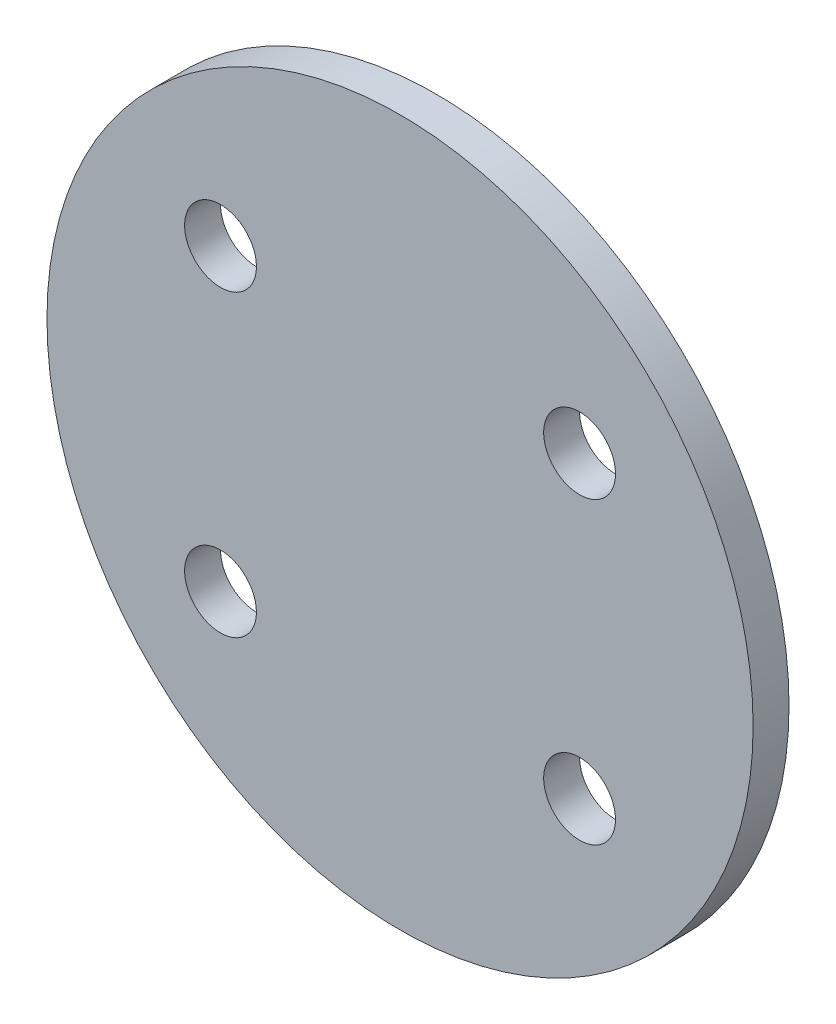
from build123d import *

# Parameters (mm, degrees)
MODEL_R             = 29.5
MODEL_R_2           = 3
BOSS_EXTRUDE1_DEPTH = 3


with BuildPart() as part:
    # Model → Boss-Extrude1 (new body)
    with BuildSketch(Plane.XY):
        Circle(MODEL_R)
        with Locations((-15, -12.5)):
            Circle(MODEL_R_2, mode=Mode.SUBTRACT)
        with Locations((15, -12.5)):
            Circle(MODEL_R_2, mode=Mode.SUBTRACT)
        with Locations((15, 12.5)):
            Circle(MODEL_R_2, mode=Mode.SUBTRACT)
        with Locations((-15, 12.5)):
            Circle(MODEL_R_2, mode=Mode.SUBTRACT)
    extrude(amount=BOSS_EXTRUDE1_DEPTH)


solid = part.part
